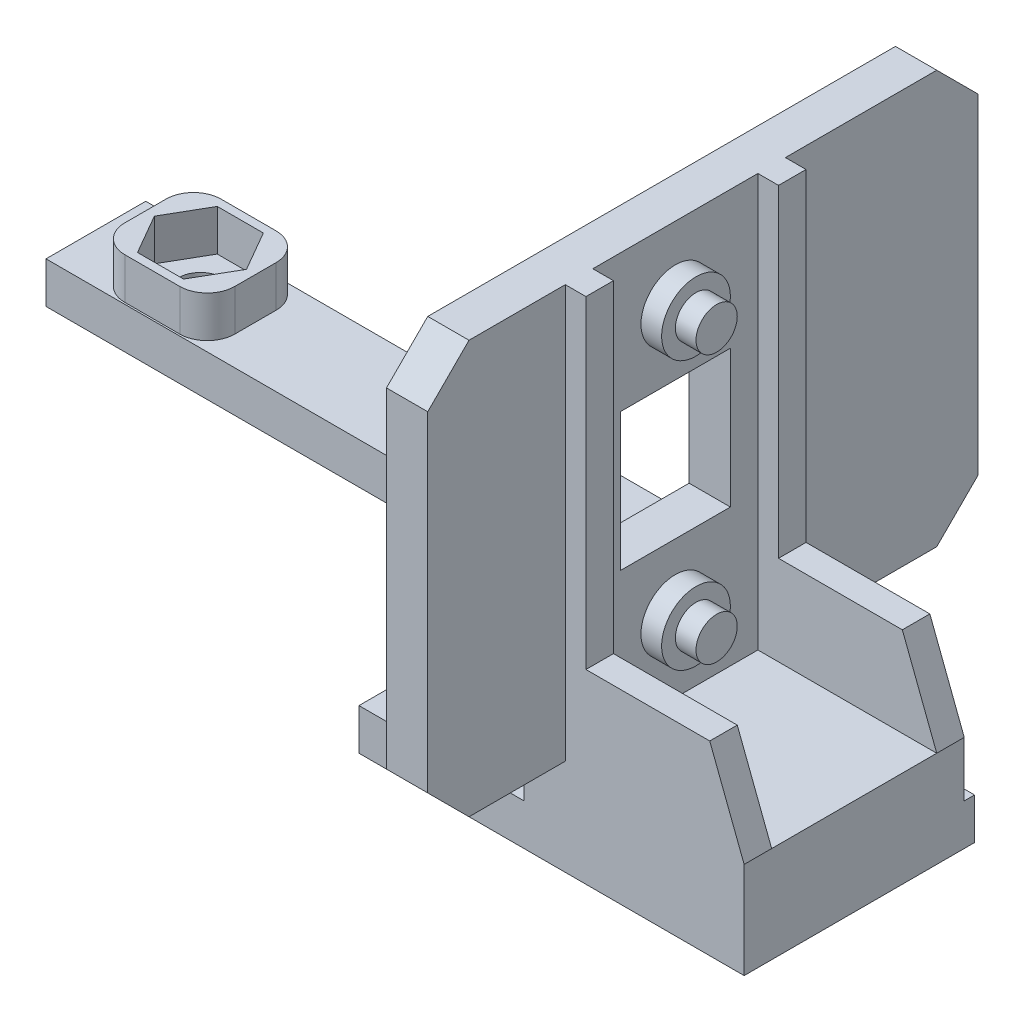
from build123d import *

# Parameters (mm, degrees)
SKETCH1_W               = 56
SKETCH1_H               = 7.25
SKETCH1_R               = 1.6
SKETCH1_W_2             = 5
SKETCH1_H_2             = 16.75
SKETCH1_W_3             = 11.5
BOSS_EXTRUDE1_DEPTH     = 3
SKETCH2_W               = 8
SKETCH2_H               = 7
BOSS_EXTRUDE2_DEPTH     = 3
FILLET1_R               = 2
SKETCH3_W               = 16
SKETCH3_H               = 16
BOSS_EXTRUDE3_DEPTH     = 4
BOSS_EXTRUDE4_DEPTH     = 3
BOSS_EXTRUDE5_DEPTH     = 2
BOSS_EXTRUDE6_DEPTH     = 2
CHAMFER1_SIZE           = 3
SKETCH8_W               = 8
SKETCH8_H               = 10
CUT_EXTRUDE1_DEPTH      = 10
CUT_EXTRUDE2_DEPTH      = 74.518705103
CUT_EXTRUDE2_DEPTH_BACK = 2
CUT_EXTRUDE3_DEPTH      = 72.281133549
CUT_EXTRUDE3_DEPTH_BACK = 2
SKETCH11_R              = 1.5
BOSS_EXTRUDE7_DEPTH     = 3
SKETCH13_R              = 2.5
BOSS_EXTRUDE8_DEPTH     = 1.5


with BuildPart() as part:
    # Sketch1 → Boss-Extrude1 (new body)
    # profile 1 of 4: a face of its own
    with BuildSketch(Plane(origin=(0, 0, 0), x_dir=(1, 0, 0), z_dir=(0, 1, 0))):
        with Locations((-28, 3.625)):
            Rectangle(SKETCH1_W, SKETCH1_H)
        with Locations(Location((-7.6, 3.625, 0), (0, 0, 270))):
            Circle(SKETCH1_R, mode=Mode.SUBTRACT)
        with Locations(Location((-48.4, 3.625, 0), (0, 0, 270))):
            Circle(SKETCH1_R, mode=Mode.SUBTRACT)
    # profile 2 of 4: a face of its own
    with BuildSketch(Plane(origin=(0, 0, 0), x_dir=(1, 0, 0), z_dir=(0, 1, 0))):
        with Locations((-2.5, -8.375)):
            Rectangle(SKETCH1_W_2, SKETCH1_H_2)
    # profile 3 of 4: a face of its own
    with BuildSketch(Plane(origin=(0, 0, 0), x_dir=(1, 0, 0), z_dir=(0, 1, 0))):
        with Locations((5.75, -8.375)):
            Rectangle(SKETCH1_W_3, SKETCH1_H_2)
    # profile 4 of 4: a face of its own
    with BuildSketch(Plane(origin=(0, 0, 0), x_dir=(1, 0, 0), z_dir=(0, 1, 0))):
        with Locations((-10.75, -8.375)):
            Rectangle(SKETCH1_W_3, SKETCH1_H_2)
    extrude(amount=BOSS_EXTRUDE1_DEPTH)

    # Sketch2 → Boss-Extrude2 (add)
    # profile 1 of 2: a face of its own
    with BuildSketch(Plane(origin=(0, 3, 0), x_dir=(1, 0, 0), z_dir=(0, 1, 0))):
        with Locations((-48.4, 3.625)):
            Rectangle(SKETCH2_W, SKETCH2_H)
        Polygon((-46.725684219, 0.725), (-45.051368439, 3.625), (-46.725684219, 6.525), (-50.074315781, 6.525), (-51.748631561, 3.625), (-50.074315781, 0.725), align=None, mode=Mode.SUBTRACT)
    # profile 2 of 2: a face of its own
    with BuildSketch(Plane(origin=(0, 3, 0), x_dir=(1, 0, 0), z_dir=(0, 1, 0))):
        with Locations((-7.6, 3.625)):
            Rectangle(SKETCH2_W, SKETCH2_H)
        Polygon((-5.925684219, 0.725), (-4.251368439, 3.625), (-5.925684219, 6.525), (-9.274315781, 6.525), (-10.948631561, 3.625), (-9.274315781, 0.725), align=None, mode=Mode.SUBTRACT)
    extrude(amount=BOSS_EXTRUDE2_DEPTH)

    # Fillet1
    fillet1_edges = [part.edges().sort_by_distance(p)[0] for p in [
        (-44.4, 4.5, -0.125),
        (-44.4, 4.5, -7.125),
        (-52.4, 4.5, -7.125),
        (-52.4, 4.5, -0.125),
        (-3.6, 4.5, -0.125),
        (-3.6, 4.5, -7.125),
        (-11.6, 4.5, -7.125),
        (-11.6, 4.5, -0.125),
    ]]
    fillet(fillet1_edges, radius=FILLET1_R)

    # Sketch3 → Boss-Extrude3 (add)
    with BuildSketch(Plane(origin=(0, 3, 0), x_dir=(1, 0, 0), z_dir=(0, 1, 0))):
        with Locations((3.5, -8.75)):
            Rectangle(SKETCH3_W, SKETCH3_H)
    extrude(amount=BOSS_EXTRUDE3_DEPTH)

    # Sketch5 → Boss-Extrude4 (add)
    with BuildSketch(Plane.ZY.offset(4.5)):
        Polygon((-13.25, 7), (0.75, 7), (16.75, 7), (26.75, 7), (26.75, 37), (-13.25, 37), align=None)
    extrude(amount=-BOSS_EXTRUDE4_DEPTH)

    # Sketch6 → Boss-Extrude5 (add)
    with BuildSketch(Plane.XY.offset(16.75)):
        Polygon((-1.5, 37), (0, 37), (11.5, 7), (-1.5, 7), align=None)
    extrude(amount=-BOSS_EXTRUDE5_DEPTH)

    # Sketch7 → Boss-Extrude6 (add)
    with BuildSketch(Plane(origin=(0, 0, 0.75), x_dir=(-1, 0, 0), z_dir=(0, 0, -1))):
        Polygon((1.5, 37), (0, 37), (-11.5, 7), (1.5, 7), align=None)
    extrude(amount=-BOSS_EXTRUDE6_DEPTH)

    # Chamfer1
    chamfer1_edges = [part.edges().sort_by_distance(p)[0] for p in [
        (-3, 7, -13.25),
        (-3, 37, -13.25),
        (-3, 37, 26.75),
        (-3, 7, 26.75),
    ]]
    chamfer(chamfer1_edges, length=CHAMFER1_SIZE)

    # Sketch8 → Cut-Extrude1 (cut)
    with BuildSketch(Plane(origin=(-1.5, 0, 0), x_dir=(0, 0, -1), z_dir=(1, 0, 0))):
        with Locations((-8.75, 22)):
            Rectangle(SKETCH8_W, SKETCH8_H)
    extrude(amount=-CUT_EXTRUDE1_DEPTH, mode=Mode.SUBTRACT)

    # Sketch9 → Cut-Extrude2 (cut, two sides: drawn at the far end of the back side and taken through both)
    with BuildSketch(Plane.XY.offset(16.75).offset(-CUT_EXTRUDE2_DEPTH_BACK)):
        Polygon((0, 185.220530074), (0, 37), (0, 13.52173913), (9, 13.52173913), (157.220530074, 13.52173913), (375.851096448, 213.716588185), (218.630566375, 385.415379128), align=None)
    extrude(amount=CUT_EXTRUDE2_DEPTH + CUT_EXTRUDE2_DEPTH_BACK, mode=Mode.SUBTRACT)

    # Sketch10 → Cut-Extrude3 (cut, two sides: drawn at the far end of the back side and taken through both)
    with BuildSketch(Plane.XY.offset(2.75).offset(-CUT_EXTRUDE3_DEPTH_BACK)):
        Polygon((0, 185.220530074), (0, 37), (0, 13.52173913), (9, 13.52173913), (157.220530074, 13.52173913), (375.851096448, 213.716588185), (218.630566375, 385.415379128), align=None)
    extrude(amount=CUT_EXTRUDE3_DEPTH + CUT_EXTRUDE3_DEPTH_BACK, mode=Mode.SUBTRACT)

    # Sketch11 → Boss-Extrude7 (add)
    with BuildSketch(Plane(origin=(-1.5, 0, 0), x_dir=(0, 0, -1), z_dir=(1, 0, 0))):
        with Locations(Location((-8.75, 31.75, 0), (0, 0, 180))):
            Circle(SKETCH11_R)
        with Locations(Location((-8.75, 12.25, 0), (0, 0, 180))):
            Circle(SKETCH11_R)
    extrude(amount=BOSS_EXTRUDE7_DEPTH)

    # Sketch13 → Boss-Extrude8 (add)
    with BuildSketch(Plane(origin=(-1.5, 0, 0), x_dir=(0, 0, -1), z_dir=(1, 0, 0))):
        with Locations(Location((-8.75, 31.75, 0), (0, 0, 180))):
            Circle(SKETCH13_R)
        with Locations(Location((-8.75, 12.25, 0), (0, 0, 180))):
            Circle(SKETCH13_R)
    extrude(amount=BOSS_EXTRUDE8_DEPTH)


solid = part.part
